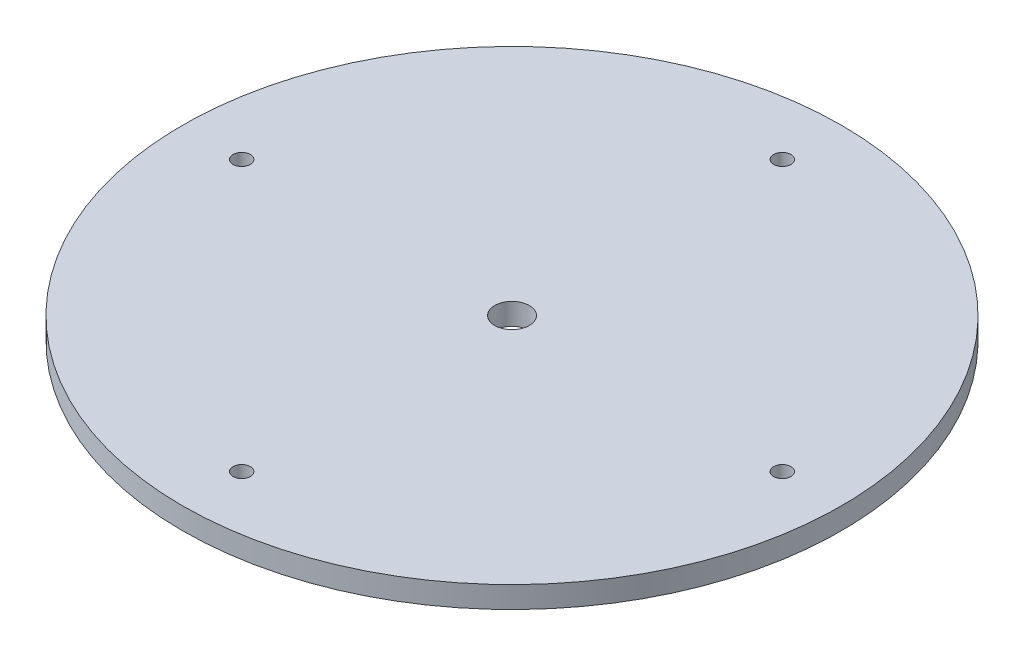
from build123d import *

# Parameters (mm, degrees)
SKETCH1_R           = 76.2
SKETCH1_R_2         = 4
BOSS_EXTRUDE2_DEPTH = 5
SKETCH2_R           = 2
CUT_EXTRUDE1_DEPTH  = 108.879006299


with BuildPart() as part:
    # Sketch1 → Boss-Extrude2 (new body)
    with BuildSketch(Plane(origin=(0, 0, 0), x_dir=(1, 0, 0), z_dir=(0, 1, 0))):
        with Locations(Location((0, 0, 0), (0, 0, 270))):
            Circle(SKETCH1_R)
        with Locations(Location((0, 0, 0), (0, 0, 270))):
            Circle(SKETCH1_R_2, mode=Mode.SUBTRACT)
    extrude(amount=BOSS_EXTRUDE2_DEPTH)

    # Sketch2 → Cut-Extrude1 (cut, through all)
    with BuildSketch(Plane(origin=(0, 5, 0), x_dir=(1, 0, 0), z_dir=(0, 1, 0))):
        with Locations(Location((0, -62.5, 0), (0, 0, 270))):
            Circle(SKETCH2_R)
        with Locations(Location((-62.5, 0, 0), (0, 0, 270))):
            Circle(SKETCH2_R)
        with Locations(Location((0, 62.5, 0), (0, 0, 270))):
            Circle(SKETCH2_R)
        with Locations(Location((62.5, 0, 0), (0, 0, 270))):
            Circle(SKETCH2_R)
    extrude(amount=-CUT_EXTRUDE1_DEPTH, mode=Mode.SUBTRACT)


solid = part.part
